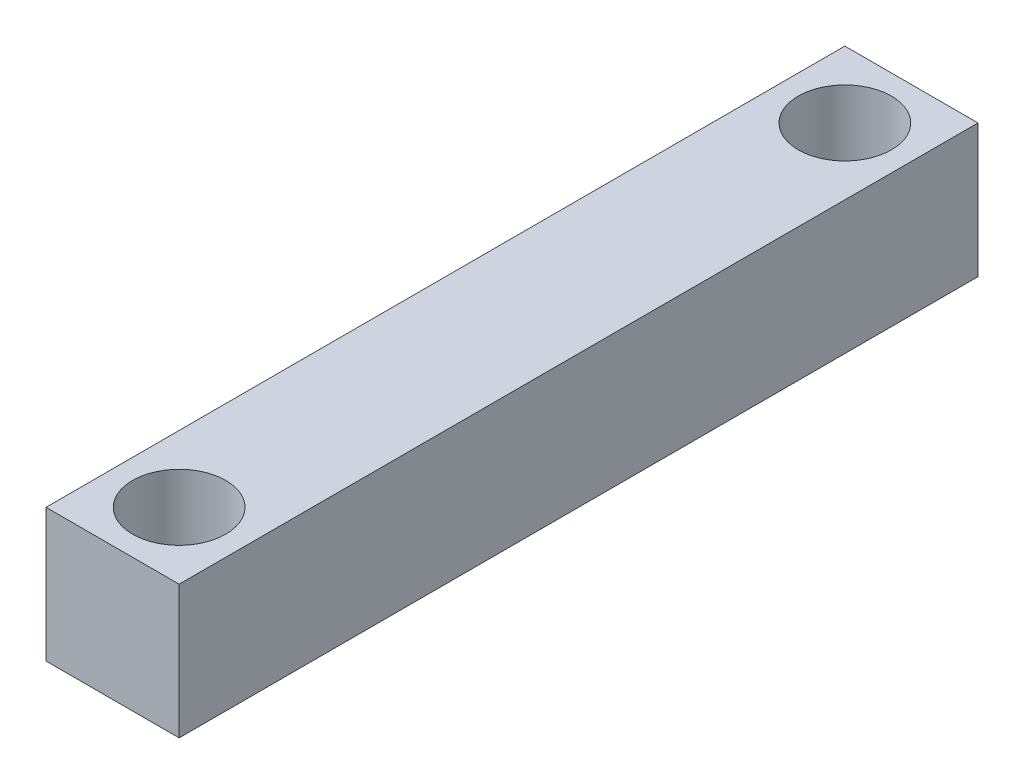
from build123d import *

# Parameters (mm, degrees)
SCHIZZO1_W                   = 5
SCHIZZO1_H                   = 5
ESTRUSIONE_ESTRUSIONE1_DEPTH = 30
SCHIZZO2_R                   = 1.75
TAGLIO_ESTRUSIONE1_DEPTH     = 31.822070015


with BuildPart() as part:
    # Schizzo1 → Estrusione-Estrusione1 (new body)
    with BuildSketch(Plane.XY):
        with Locations((-2.5, 2.5)):
            Rectangle(SCHIZZO1_W, SCHIZZO1_H)
    extrude(amount=ESTRUSIONE_ESTRUSIONE1_DEPTH)

    # Schizzo2 → Taglio-Estrusione1 (cut, through all)
    with BuildSketch(Plane(origin=(0, 0, 0), x_dir=(-1, 0, 0), z_dir=(0, -1, 0))):
        with Locations(Location((2.5, -27.5, 0), (0, 0, 180))):
            Circle(SCHIZZO2_R)
        with Locations(Location((2.5, -2.5, 0), (0, 0, 180))):
            Circle(SCHIZZO2_R)
    extrude(amount=-TAGLIO_ESTRUSIONE1_DEPTH, mode=Mode.SUBTRACT)


solid = part.part
